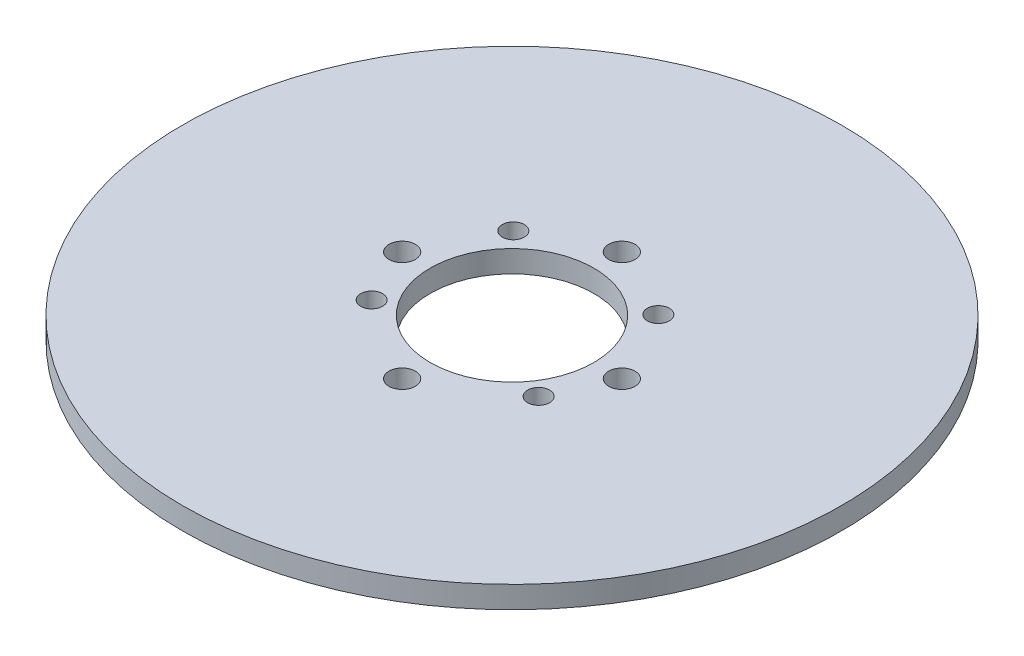
from build123d import *

# Parameters (mm, degrees)
SKETCH1_R           = 150
SKETCH1_R_2         = 5
SKETCH1_R_3         = 37.25
SKETCH1_R_4         = 6
BOSS_EXTRUDE1_DEPTH = 10


with BuildPart() as part:
    # Sketch1 → Boss-Extrude1 (new body)
    with BuildSketch(Plane(origin=(0, 0, 0), x_dir=(1, 0, 0), z_dir=(0, 1, 0))):
        with Locations(Location((0, -3, 0), (0, 0, 270))):
            Circle(SKETCH1_R)
        with Locations(Location((-33, 30.594117082, 0), (0, 0, 270))):
            Circle(SKETCH1_R_2, mode=Mode.SUBTRACT)
        with Locations(Location((33, 30.594117082, 0), (0, 0, 270))):
            Circle(SKETCH1_R_2, mode=Mode.SUBTRACT)
        with Locations(Location((38, -28.896134221, 0), (0, 0, 270))):
            Circle(SKETCH1_R_2, mode=Mode.SUBTRACT)
        with Locations(Location((-38, -28.896134221, 0), (0, 0, 270))):
            Circle(SKETCH1_R_2, mode=Mode.SUBTRACT)
        with Locations(Location((0, -3, 0), (0, 0, 270))):
            Circle(SKETCH1_R_3, mode=Mode.SUBTRACT)
        with Locations(Location((0, 47, 0), (0, 0, 270))):
            Circle(SKETCH1_R_4, mode=Mode.SUBTRACT)
        with Locations(Location((50, -3, 0), (0, 0, 270))):
            Circle(SKETCH1_R_4, mode=Mode.SUBTRACT)
        with Locations(Location((0, -53, 0), (0, 0, 270))):
            Circle(SKETCH1_R_4, mode=Mode.SUBTRACT)
        with Locations(Location((-50, -3, 0), (0, 0, 270))):
            Circle(SKETCH1_R_4, mode=Mode.SUBTRACT)
    extrude(amount=BOSS_EXTRUDE1_DEPTH)


solid = part.part
